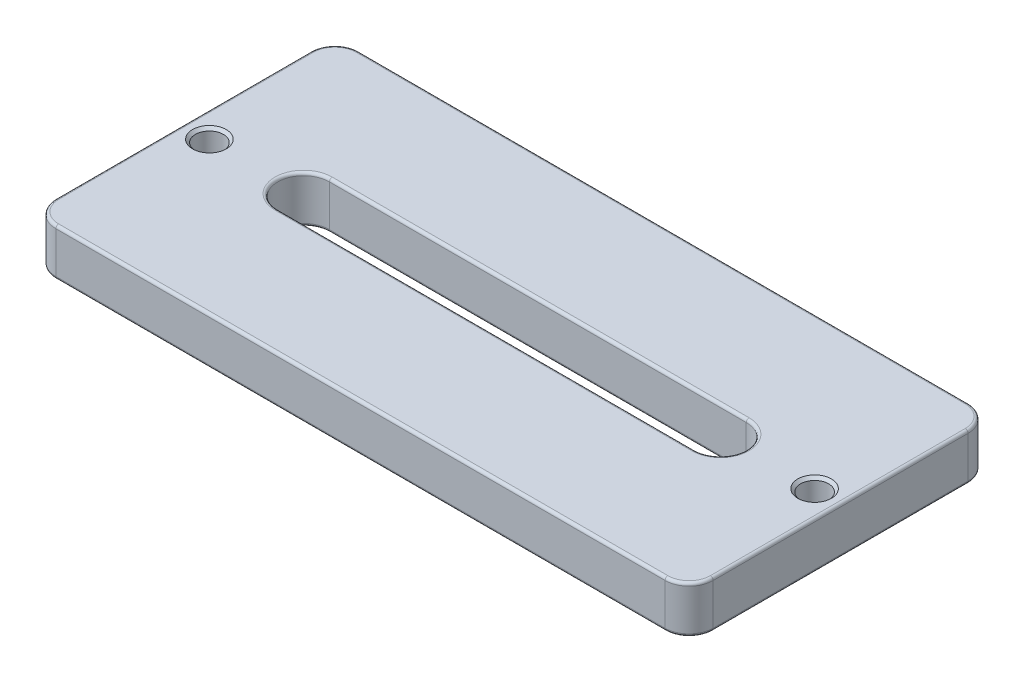
from build123d import *

# Parameters (mm, degrees)
SKETCH1_W           = 82
SKETCH1_H           = 37.8
SKETCH1_R           = 1.75
BOSS_EXTRUDE1_DEPTH = 5.85
FILLET2_R           = 3
FILLET3_R           = 0.35
CHAMFER1_SIZE       = 0.35


with BuildPart() as part:
    # Sketch1 → Boss-Extrude1 (new body)
    with BuildSketch(Plane(origin=(0, 0, 0), x_dir=(1, 0, 0), z_dir=(0, 1, 0))):
        Rectangle(SKETCH1_W, SKETCH1_H)
        with Locations(Location((37.75, 0, 0), (0, 0, 270))):
            Circle(SKETCH1_R, mode=Mode.SUBTRACT)
        with Locations(Location((-37.75, 0, 0), (0, 0, 270))):
            Circle(SKETCH1_R, mode=Mode.SUBTRACT)
        with BuildLine():
            Line((-25.9975, 3.225), (-13.623486154, 3.225))
            Line((-13.623486154, 3.225), (13.623486154, 3.225))
            Line((13.623486154, 3.225), (25.9975, 3.225))
            ThreePointArc((25.9975, 3.225), (29.2225, 0), (25.9975, -3.225))
            Line((25.9975, -3.225), (13.623486154, -3.225))
            Line((13.623486154, -3.225), (-13.623486154, -3.225))
            Line((-13.623486154, -3.225), (-25.9975, -3.225))
            ThreePointArc((-25.9975, -3.225), (-29.2225, 0), (-25.9975, 3.225))
        make_face(mode=Mode.SUBTRACT)
    extrude(amount=BOSS_EXTRUDE1_DEPTH)

    # Fillet2
    fillet2_edges = [part.edges().sort_by_distance(p)[0] for p in [
        (-41, 2.925, -18.9),
        (41, 2.925, -18.9),
        (41, 2.925, 18.9),
        (-41, 2.925, 18.9),
    ]]
    fillet(fillet2_edges, radius=FILLET2_R)

    # Fillet3
    fillet3_edges = [part.edges().sort_by_distance(p)[0] for p in [
        (-29.2225, 0, 0),
        (0, 0, 3.225),
        (29.2225, 0, 0),
        (0, 0, -3.225),
        (0, 5.85, -3.225),
        (-29.2225, 5.85, 0),
        (0, 5.85, 3.225),
        (29.2225, 5.85, 0),
        (0, 0, -18.9),
        (0, 5.85, -18.9),
        (-41, 0, 0),
        (41, 0, 0),
        (0, 0, 18.9),
        (-40.121320344, 0, 18.021320344),
        (-40.121320344, 0, -18.021320344),
        (40.121320344, 0, 18.021320344),
        (40.121320344, 0, -18.021320344),
        (41, 5.85, 0),
        (-41, 5.85, 0),
        (0, 5.85, 18.9),
        (-40.121320344, 5.85, 18.021320344),
        (-40.121320344, 5.85, -18.021320344),
        (40.121320344, 5.85, 18.021320344),
        (40.121320344, 5.85, -18.021320344),
    ]]
    fillet(fillet3_edges, radius=FILLET3_R)

    # Chamfer1
    chamfer1_edges = [part.edges().sort_by_distance(p)[0] for p in [
        (37.75, 0, -1.75),
        (37.75, 5.85, -1.75),
        (-37.75, 0, -1.75),
        (-37.75, 5.85, -1.75),
    ]]
    chamfer(chamfer1_edges, length=CHAMFER1_SIZE)


solid = part.part
